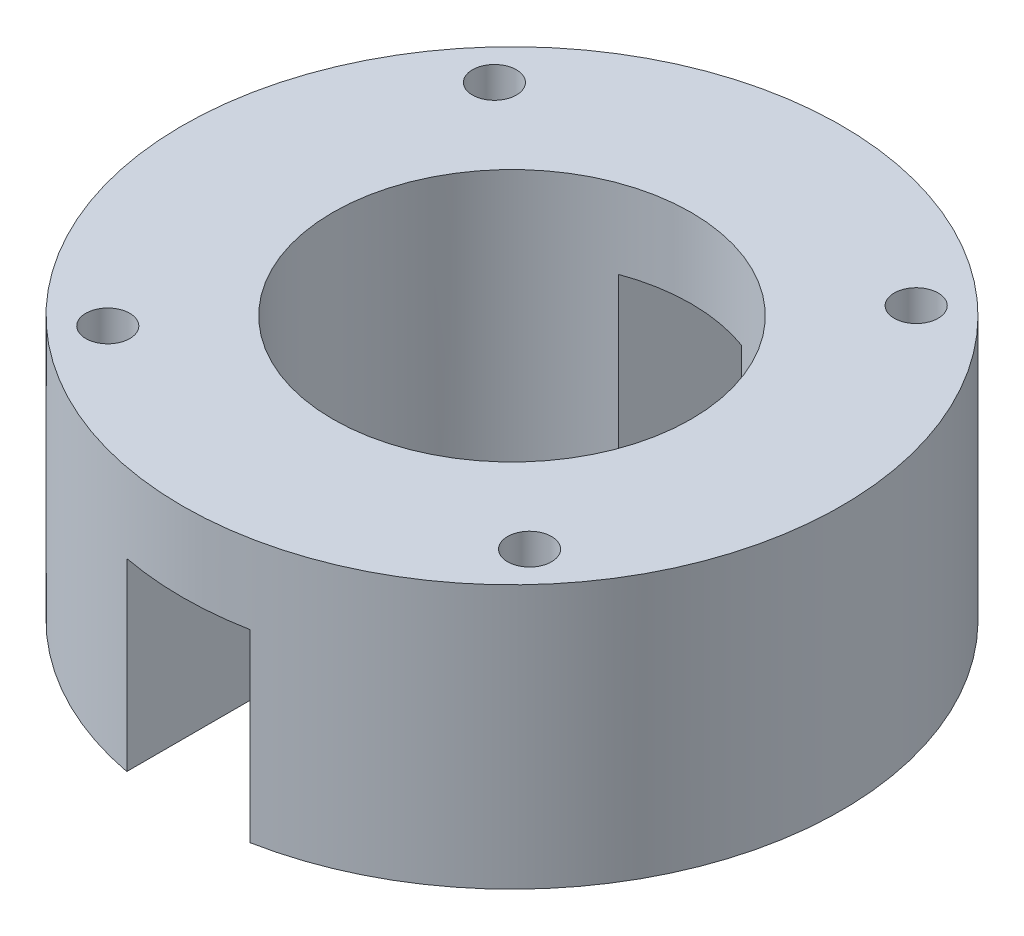
from build123d import *

# Parameters (mm, degrees)
SKETCH2_R           = 37.5
BOSS_EXTRUDE1_DEPTH = 30
SKETCH4_R           = 2.5
CUT_EXTRUDE2_DEPTH  = 25
SKETCH5_W           = 14
SKETCH5_H           = 42
CUT_EXTRUDE3_DEPTH  = 57.5
SKETCH6_R           = 20.385544883
CUT_EXTRUDE4_DEPTH  = 57.5


with BuildPart() as part:
    # Sketch2 → Boss-Extrude1 (new body)
    with BuildSketch(Plane(origin=(0, 0, 0), x_dir=(1, 0, 0), z_dir=(0, 1, 0))):
        with Locations(Location((0, 0, 0), (0, 0, 270))):
            Circle(SKETCH2_R)
    extrude(amount=BOSS_EXTRUDE1_DEPTH)

    # Sketch4 → Cut-Extrude2 (cut)
    with BuildSketch(Plane(origin=(0, 30, 0), x_dir=(1, 0, 0), z_dir=(0, 1, 0))):
        with Locations(Location((22, 24, 0), (0, 0, 270))):
            Circle(SKETCH4_R)
        with Locations(Location((24, -22, 0), (0, 0, 270))):
            Circle(SKETCH4_R)
        with Locations(Location((-22, -24, 0), (0, 0, 270))):
            Circle(SKETCH4_R)
        with Locations(Location((-24, 22, 0), (0, 0, 270))):
            Circle(SKETCH4_R)
    extrude(amount=-CUT_EXTRUDE2_DEPTH, mode=Mode.SUBTRACT)

    # Sketch5 → Cut-Extrude3 (cut, symmetric)
    with BuildSketch(Plane.XY):
        Rectangle(SKETCH5_W, SKETCH5_H)
    extrude(amount=CUT_EXTRUDE3_DEPTH, both=True, mode=Mode.SUBTRACT)

    # Sketch6 → Cut-Extrude4 (cut, symmetric)
    with BuildSketch(Plane(origin=(0, 30, 0), x_dir=(1, 0, 0), z_dir=(0, 1, 0))):
        with Locations(Location((0, 0, 0), (0, 0, 270))):
            Circle(SKETCH6_R)
    extrude(amount=CUT_EXTRUDE4_DEPTH, both=True, mode=Mode.SUBTRACT)


solid = part.part
